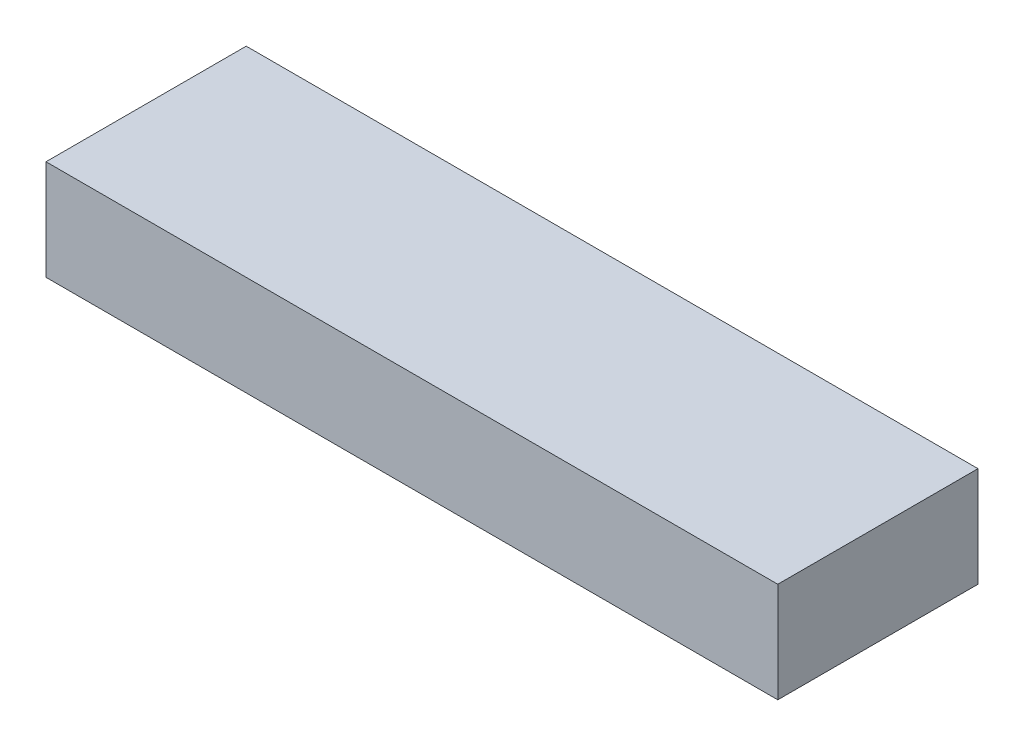
from build123d import *

# Parameters (mm, degrees)
SKETCH1_W           = 73.1
SKETCH1_H           = 20
BOSS_EXTRUDE1_DEPTH = 10


with BuildPart() as part:
    # Sketch1 → Boss-Extrude1 (new body)
    with BuildSketch(Plane(origin=(0, 0, 0), x_dir=(1, 0, 0), z_dir=(0, 1, 0))):
        with Locations((36.55, 10)):
            Rectangle(SKETCH1_W, SKETCH1_H)
    extrude(amount=BOSS_EXTRUDE1_DEPTH)


solid = part.part
